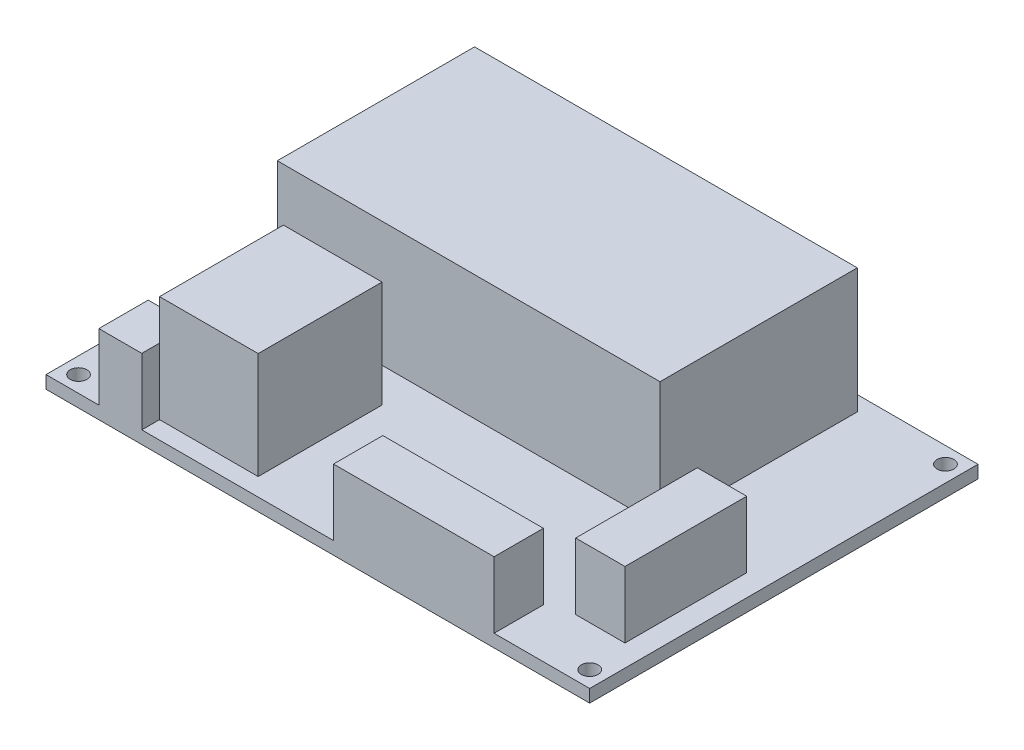
from build123d import *

# Parameters (mm, degrees)
SKETCH1_W               = 70
SKETCH1_H               = 50
BOSS_EXTRUDE1_DEPTH     = 1.6383
SKETCH3_R               = 1.0795
CUT_EXTRUDE2_DEPTH      = 87.038851845
MIRROR2_COPY_1_SKETCH_R = 1.0795
MIRROR2_COPY_1_DEPTH    = 87.038851845
SKETCH4_W               = 6.35
SKETCH4_H               = 15.6718
SKETCH4_W_2             = 20.6756
SKETCH4_H_2             = 6.35
SKETCH4_W_3             = 5.5245
BOSS_EXTRUDE2_DEPTH     = 8.5344
SKETCH5_W               = 12.7
SKETCH5_H               = 15.9512
BOSS_EXTRUDE3_DEPTH     = 13.716
SKETCH7_W               = 49.276
SKETCH7_H               = 25.4
BOSS_EXTRUDE4_DEPTH     = 16.0655


with BuildPart() as part:
    # Sketch1 → Boss-Extrude1 (new body)
    with BuildSketch(Plane(origin=(0, 0, 0), x_dir=(1, 0, 0), z_dir=(0, 1, 0))):
        with Locations((35, 25)):
            Rectangle(SKETCH1_W, SKETCH1_H)
    extrude(amount=BOSS_EXTRUDE1_DEPTH)

    # Sketch3 → Cut-Extrude2 (cut, through all)
    with BuildSketch(Plane(origin=(0, 1.6383, 0), x_dir=(1, 0, 0), z_dir=(0, 1, 0))):
        with Locations(Location((2.0955, 2.0955, 0), (0, 0, 270))):
            Circle(SKETCH3_R)
    cut_extrude2 = extrude(amount=-CUT_EXTRUDE2_DEPTH, mode=Mode.SUBTRACT)

    # Mirror1: Cut-Extrude2 across plane
    add(cut_extrude2.mirror(Plane.XY.offset(-25)), mode=Mode.SUBTRACT)

    # Mirror2: Cut-Extrude2 across plane
    add(cut_extrude2.mirror(Plane(origin=(35, 0, 0), x_dir=(0, 0, 1), z_dir=(1, 0, 0))), mode=Mode.SUBTRACT)

    # Mirror2 copy 1 sketch → Mirror2 copy 1 (cut, through all)
    with BuildSketch(Plane(origin=(70, 1.6383, -50), x_dir=(-1, 0, 0), z_dir=(0, 1, 0))):
        with Locations(Location((2.0955, 2.0955, 0), (0, 0, 270))):
            Circle(MIRROR2_COPY_1_SKETCH_R)
    extrude(amount=-MIRROR2_COPY_1_DEPTH, mode=Mode.SUBTRACT)

    # Sketch4 → Boss-Extrude2 (add)
    with BuildSketch(Plane(origin=(0, 1.6383, 0), x_dir=(1, 0, 0), z_dir=(0, 1, 0))):
        with Locations((64.031, 15.1765)):
            Rectangle(SKETCH4_W, SKETCH4_H)
        with Locations((47.3559, 3.175)):
            Rectangle(SKETCH4_W_2, SKETCH4_H_2)
        with Locations((9.56945, 3.175)):
            Rectangle(SKETCH4_W_3, SKETCH4_H_2)
    extrude(amount=BOSS_EXTRUDE2_DEPTH)

    # Sketch5 → Boss-Extrude3 (add)
    with BuildSketch(Plane(origin=(0, 1.6383, 0), x_dir=(1, 0, 0), z_dir=(0, 1, 0))):
        with Locations((18.6817, 10.2616)):
            Rectangle(SKETCH5_W, SKETCH5_H)
    extrude(amount=BOSS_EXTRUDE3_DEPTH)

    # Sketch7 → Boss-Extrude4 (add)
    with BuildSketch(Plane(origin=(0, 1.6383, 0), x_dir=(1, 0, 0), z_dir=(0, 1, 0))):
        with Locations((31.75, 35.3696)):
            Rectangle(SKETCH7_W, SKETCH7_H)
    extrude(amount=BOSS_EXTRUDE4_DEPTH)


solid = part.part
